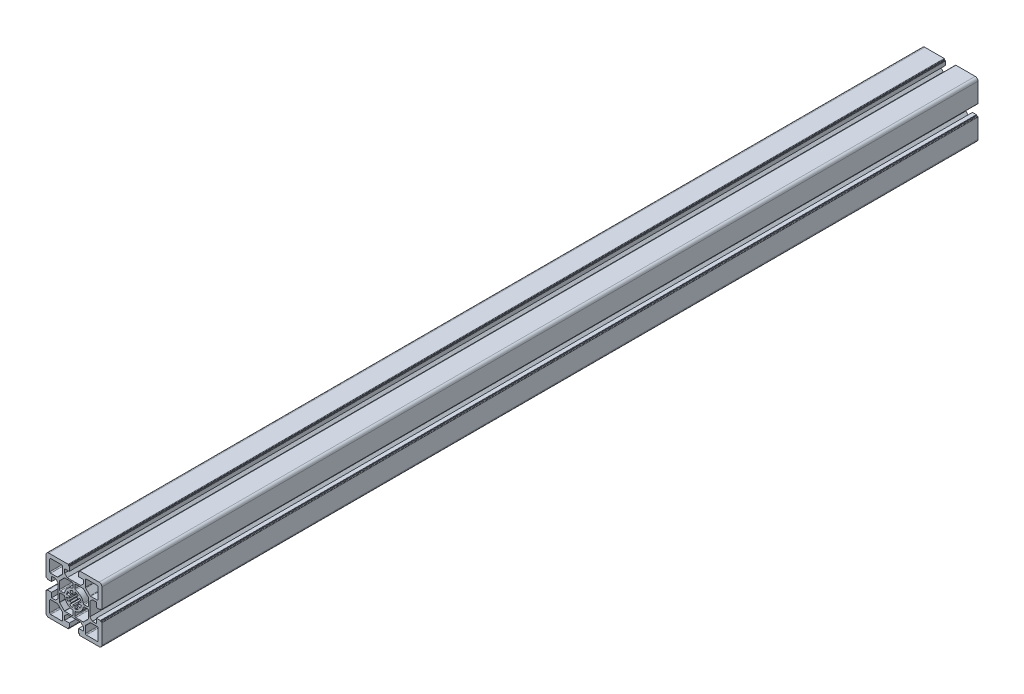
from build123d import *

# Parameters (mm, degrees)
BASE_EXTRUDE_DEPTH = 940
ESCALA1_SCALE      = 0.5


with BuildPart() as part:
    # Sketch1 → Base-Extrude (new body)
    with BuildSketch(Plane.XY):
        with BuildLine():
            Line((7.24997588, 17.000014817), (-2.412e-05, 17.000014817))
            Line((-2.412e-05, 17.000014817), (-7.25002412, 17.000014817))
            Line((-7.25002412, 17.000014817), (-10.05002512, 19.800013819))
            Line((-10.05002512, 19.800013819), (-10.05002512, 24.000014819))
            Line((-10.05002512, 24.000014819), (-5.00002412, 24.000014819))
            Line((-5.00002412, 24.000014819), (-5.00002412, 28.20002069))
            ThreePointArc((-5.00002412, 28.20002069), (-5.08789044, 28.41214864), (-5.300018455, 28.500014819))
            Line((-5.300018455, 28.500014819), (-5.500021455, 28.500014819))
            ThreePointArc((-5.500021455, 28.500014819), (-5.712152769, 28.587882347), (-5.800020455, 28.800013596))
            Line((-5.800020455, 28.800013596), (-5.800020455, 29.500015192))
            ThreePointArc((-5.800020455, 29.500015192), (-5.946466955, 29.853568318), (-6.300020081, 30.000014817))
            Line((-6.300020081, 30.000014817), (-27.000022696, 30.000014817))
            ThreePointArc((-27.000022696, 30.000014817), (-29.121341455, 29.121335817), (-30.000020455, 27.000017059))
            Line((-30.000020455, 27.000017059), (-30.000020455, 6.300013444))
            ThreePointArc((-30.000020455, 6.300013444), (-29.853573955, 5.946460317), (-29.500020828, 5.800013817))
            Line((-29.500020828, 5.800013817), (-28.800019731, 5.800013817))
            ThreePointArc((-28.800019731, 5.800013817), (-28.587888208, 5.712146064), (-28.500020455, 5.500014542))
            Line((-28.500020455, 5.500014542), (-28.500020455, 5.300014093))
            ThreePointArc((-28.500020455, 5.300014093), (-28.412152701, 5.087882571), (-28.200021179, 5.000014817))
            Line((-28.200021179, 5.000014817), (-24.000020455, 5.000014817))
            Line((-24.000020455, 5.000014817), (-24.000020455, 10.050012866))
            Line((-24.000020455, 10.050012866), (-19.800019665, 10.050012866))
            Line((-19.800019665, 10.050012866), (-17.000019665, 7.250013866))
            Line((-17.000019665, 7.250013866), (-17.000019665, 4.3167e-05))
            Line((-17.000019665, 4.3167e-05), (-17.000019665, -7.249956831))
            Line((-17.000019665, -7.249956831), (-19.800019665, -10.049955831))
            Line((-19.800019665, -10.049955831), (-24.000020455, -10.049955831))
            Line((-24.000020455, -10.049955831), (-24.000020455, -4.999957783))
            Line((-24.000020455, -4.999957783), (-28.200021179, -4.999957783))
            ThreePointArc((-28.200021179, -4.999957783), (-28.412152701, -5.087825536), (-28.500020455, -5.299957058))
            Line((-28.500020455, -5.299957058), (-28.500020455, -5.499957507))
            ThreePointArc((-28.500020455, -5.499957507), (-28.587888208, -5.712089029), (-28.800019731, -5.799956783))
            Line((-28.800019731, -5.799956783), (-29.500020828, -5.799956783))
            ThreePointArc((-29.500020828, -5.799956783), (-29.853573955, -5.946403283), (-30.000020455, -6.299956409))
            Line((-30.000020455, -6.299956409), (-30.000020455, -26.999960024))
            ThreePointArc((-30.000020455, -26.999960024), (-29.121341455, -29.121278783), (-27.000022696, -29.999957783))
            Line((-27.000022696, -29.999957783), (-6.300020081, -29.999957783))
            ThreePointArc((-6.300020081, -29.999957783), (-5.946466955, -29.853511283), (-5.800020455, -29.499958157))
            Line((-5.800020455, -29.499958157), (-5.800020455, -28.799956561))
            ThreePointArc((-5.800020455, -28.799956561), (-5.712152769, -28.587825312), (-5.500021455, -28.499957784))
            Line((-5.500021455, -28.499957784), (-5.300018455, -28.499957784))
            ThreePointArc((-5.300018455, -28.499957784), (-5.08789044, -28.412091605), (-5.00002412, -28.199963655))
            Line((-5.00002412, -28.199963655), (-5.00002412, -23.999957784))
            Line((-5.00002412, -23.999957784), (-10.05002512, -23.999957784))
            Line((-10.05002512, -23.999957784), (-10.05002512, -19.799956784))
            Line((-10.05002512, -19.799956784), (-7.25002412, -16.999957783))
            Line((-7.25002412, -16.999957783), (-2.412e-05, -16.999957783))
            Line((-2.412e-05, -16.999957783), (7.24997588, -16.999957783))
            Line((7.24997588, -16.999957783), (10.04997688, -19.799956784))
            Line((10.04997688, -19.799956784), (10.04997688, -23.999957784))
            Line((10.04997688, -23.999957784), (4.99997588, -23.999957784))
            Line((4.99997588, -23.999957784), (4.99997588, -28.199963655))
            ThreePointArc((4.99997588, -28.199963655), (5.0878422, -28.412091605), (5.299970215, -28.499957784))
            Line((5.299970215, -28.499957784), (5.499973215, -28.499957784))
            ThreePointArc((5.499973215, -28.499957784), (5.71210453, -28.587825312), (5.799972216, -28.799956561))
            Line((5.799972216, -28.799956561), (5.799972216, -29.499958157))
            ThreePointArc((5.799972216, -29.499958157), (5.946418716, -29.853511283), (6.299971842, -29.999957783))
            Line((6.299971842, -29.999957783), (26.999974457, -29.999957783))
            ThreePointArc((26.999974457, -29.999957783), (29.121293215, -29.121278783), (29.999972215, -26.999960024))
            Line((29.999972215, -26.999960024), (29.999972215, -6.299956409))
            ThreePointArc((29.999972215, -6.299956409), (29.853525715, -5.946403283), (29.499972589, -5.799956783))
            Line((29.499972589, -5.799956783), (28.799971491, -5.799956783))
            ThreePointArc((28.799971491, -5.799956783), (28.587839969, -5.712089029), (28.499972215, -5.499957507))
            Line((28.499972215, -5.499957507), (28.499972215, -5.299957058))
            ThreePointArc((28.499972215, -5.299957058), (28.412104462, -5.087825536), (28.199972939, -4.999957783))
            Line((28.199972939, -4.999957783), (23.999972215, -4.999957783))
            Line((23.999972215, -4.999957783), (23.999972215, -10.049955831))
            Line((23.999972215, -10.049955831), (19.799971426, -10.049955831))
            Line((19.799971426, -10.049955831), (16.999971426, -7.249956831))
            Line((16.999971426, -7.249956831), (16.999971426, 4.3167e-05))
            Line((16.999971426, 4.3167e-05), (16.999971426, 7.250013866))
            Line((16.999971426, 7.250013866), (19.799971426, 10.050012866))
            Line((19.799971426, 10.050012866), (23.999972215, 10.050012866))
            Line((23.999972215, 10.050012866), (23.999972215, 5.000014817))
            Line((23.999972215, 5.000014817), (28.199972939, 5.000014817))
            ThreePointArc((28.199972939, 5.000014817), (28.412104462, 5.087882571), (28.499972215, 5.300014093))
            Line((28.499972215, 5.300014093), (28.499972215, 5.500014542))
            ThreePointArc((28.499972215, 5.500014542), (28.587839969, 5.712146064), (28.799971491, 5.800013817))
            Line((28.799971491, 5.800013817), (29.499972589, 5.800013817))
            ThreePointArc((29.499972589, 5.800013817), (29.853525715, 5.946460317), (29.999972215, 6.300013444))
            Line((29.999972215, 6.300013444), (29.999972215, 27.000017059))
            ThreePointArc((29.999972215, 27.000017059), (29.121293215, 29.121335817), (26.999974457, 30.000014817))
            Line((26.999974457, 30.000014817), (6.299971842, 30.000014817))
            ThreePointArc((6.299971842, 30.000014817), (5.946418716, 29.853568318), (5.799972216, 29.500015192))
            Line((5.799972216, 29.500015192), (5.799972216, 28.800013596))
            ThreePointArc((5.799972216, 28.800013596), (5.71210453, 28.587882347), (5.499973215, 28.500014819))
            Line((5.499973215, 28.500014819), (5.299970215, 28.500014819))
            ThreePointArc((5.299970215, 28.500014819), (5.0878422, 28.41214864), (4.99997588, 28.20002069))
            Line((4.99997588, 28.20002069), (4.99997588, 24.000014819))
            Line((4.99997588, 24.000014819), (10.04997688, 24.000014819))
            Line((10.04997688, 24.000014819), (10.04997688, 19.800013819))
            Line((10.04997688, 19.800013819), (7.24997588, 17.000014817))
        make_face()
        with BuildLine():
            Line((24.999970687, 12.300015508), (17.964182773, 12.300015508))
            ThreePointArc((17.964182773, 12.300015508), (17.581498992, 12.376136067), (17.257075378, 12.59290907))
            Line((17.257075378, 12.59290907), (12.592863552, 17.257122896))
            ThreePointArc((12.592863552, 17.257122896), (12.376090508, 17.581546796), (12.29996994, 17.964230842))
            Line((12.29996994, 17.964230842), (12.29996994, 25.000017255))
            ThreePointArc((12.29996994, 25.000017255), (12.59286294, 25.707123508), (13.299969193, 26.000016508))
            Line((13.299969193, 26.000016508), (24.999970687, 26.000016508))
            ThreePointArc((24.999970687, 26.000016508), (25.70707694, 25.707123508), (25.99996994, 25.000017255))
            Line((25.99996994, 25.000017255), (25.99996994, 13.300014761))
            ThreePointArc((25.99996994, 13.300014761), (25.70707694, 12.592908508), (24.999970687, 12.300015508))
        make_face(mode=Mode.SUBTRACT)
        with BuildLine():
            Line((-0.868254781, 4.924047323), (-1.389203942, 7.878492919))
            ThreePointArc((-1.389203942, 7.878492919), (-3.061491097, 7.391065963), (-4.588639176, 6.553242527))
            Line((-4.588639176, 6.553242527), (-2.867900032, 4.095774325))
            ThreePointArc((-2.867900032, 4.095774325), (-3.535545186, 3.535556326), (-4.095767305, 2.867914629))
            Line((-4.095767305, 2.867914629), (-6.553231573, 4.588649719))
            ThreePointArc((-6.553231573, 4.588649719), (-7.391053065, 3.061505388), (-7.878479822, 1.389222571))
            Line((-7.878479822, 1.389222571), (-4.924052211, 0.868276934))
            ThreePointArc((-4.924052211, 0.868276934), (-5.000015145, 2.8517e-05), (-4.924052211, -0.8682199))
            Line((-4.924052211, -0.8682199), (-7.878479822, -1.389165536))
            ThreePointArc((-7.878479822, -1.389165536), (-7.391053065, -3.061448353), (-6.553231573, -4.588592684))
            Line((-6.553231573, -4.588592684), (-4.095767305, -2.867857594))
            ThreePointArc((-4.095767305, -2.867857594), (-3.535545186, -3.535499291), (-2.867900032, -4.09571729))
            Line((-2.867900032, -4.09571729), (-4.588639176, -6.553185492))
            ThreePointArc((-4.588639176, -6.553185492), (-3.061491097, -7.391008929), (-1.389203942, -7.878435884))
            Line((-1.389203942, -7.878435884), (-0.868254781, -4.923990288))
            ThreePointArc((-0.868254781, -4.923990288), (-0.435797618, -4.980922606), (-2.412e-05, -4.999947433))
            ThreePointArc((-2.412e-05, -4.999947433), (0.435749379, -4.980922606), (0.868206541, -4.923990288))
            Line((0.868206541, -4.923990288), (1.389155702, -7.878435884))
            ThreePointArc((1.389155702, -7.878435884), (3.061442857, -7.391008929), (4.588590936, -6.553185492))
            Line((4.588590936, -6.553185492), (2.867851793, -4.09571729))
            ThreePointArc((2.867851793, -4.09571729), (3.535496947, -3.535499291), (4.095719065, -2.867857594))
            Line((4.095719065, -2.867857594), (6.553183334, -4.588592684))
            ThreePointArc((6.553183334, -4.588592684), (7.391004826, -3.061448353), (7.878431582, -1.389165536))
            Line((7.878431582, -1.389165536), (4.924003972, -0.8682199))
            ThreePointArc((4.924003972, -0.8682199), (4.999966905, 2.8517e-05), (4.924003972, 0.868276934))
            Line((4.924003972, 0.868276934), (7.878431582, 1.389222571))
            ThreePointArc((7.878431582, 1.389222571), (7.391004826, 3.061505388), (6.553183334, 4.588649719))
            Line((6.553183334, 4.588649719), (4.095719065, 2.867914629))
            ThreePointArc((4.095719065, 2.867914629), (3.535496947, 3.535556326), (2.867851793, 4.095774325))
            Line((2.867851793, 4.095774325), (4.588590936, 6.553242527))
            ThreePointArc((4.588590936, 6.553242527), (3.061442857, 7.391065963), (1.389155702, 7.878492919))
            Line((1.389155702, 7.878492919), (0.868206541, 4.924047323))
            ThreePointArc((0.868206541, 4.924047323), (0.435749379, 4.980979641), (-2.412e-05, 5.000004467))
            ThreePointArc((-2.412e-05, 5.000004467), (-0.435797618, 4.980979641), (-0.868254781, 4.924047323))
        make_face(mode=Mode.SUBTRACT)
        with BuildLine():
            Line((14.499970687, 1.000016508), (10.969128525, 1.000016508))
            ThreePointArc((10.969128525, 1.000016508), (10.328572063, 1.232105996), (9.985348997, 1.820643198))
            ThreePointArc((9.985348997, 1.820643198), (7.177103386, 7.177150109), (1.820595849, 9.985394525))
            ThreePointArc((1.820595849, 9.985394525), (1.232058499, 10.328617545), (0.99996894, 10.969174093))
            Line((0.99996894, 10.969174093), (0.99996894, 14.500017255))
            ThreePointArc((0.99996894, 14.500017255), (1.29286194, 15.207123508), (1.999968193, 15.500016508))
            Line((1.999968193, 15.500016508), (9.900222627, 15.500016508))
            ThreePointArc((9.900222627, 15.500016508), (10.091564812, 15.461956186), (10.253776891, 15.353569557))
            Line((10.253776891, 15.353569557), (15.35352292, 10.253824528))
            ThreePointArc((15.35352292, 10.253824528), (15.461909599, 10.091612425), (15.49996994, 9.900270195))
            Line((15.49996994, 9.900270195), (15.49996994, 2.000015761))
            ThreePointArc((15.49996994, 2.000015761), (15.20707694, 1.292909508), (14.499970687, 1.000016508))
        make_face(mode=Mode.SUBTRACT)
        with BuildLine():
            Line((-25.000018927, -12.299958473), (-17.964231013, -12.299958473))
            ThreePointArc((-17.964231013, -12.299958473), (-17.581547231, -12.376079032), (-17.257123618, -12.592852035))
            Line((-17.257123618, -12.592852035), (-12.592911792, -17.257065861))
            ThreePointArc((-12.592911792, -17.257065861), (-12.376138748, -17.581489761), (-12.30001818, -17.964173807))
            Line((-12.30001818, -17.964173807), (-12.30001818, -24.99996022))
            ThreePointArc((-12.30001818, -24.99996022), (-12.59291118, -25.707066473), (-13.300017432, -25.999959473))
            Line((-13.300017432, -25.999959473), (-25.000018927, -25.999959473))
            ThreePointArc((-25.000018927, -25.999959473), (-25.70712518, -25.707066473), (-26.00001818, -24.99996022))
            Line((-26.00001818, -24.99996022), (-26.00001818, -13.299957726))
            ThreePointArc((-26.00001818, -13.299957726), (-25.70712518, -12.592851473), (-25.000018927, -12.299958473))
        make_face(mode=Mode.SUBTRACT)
        with BuildLine():
            Line((-14.500018927, -0.999959473), (-10.969176764, -0.999959473))
            ThreePointArc((-10.969176764, -0.999959473), (-10.328620302, -1.232048961), (-9.985397236, -1.820586163))
            ThreePointArc((-9.985397236, -1.820586163), (-7.177151626, -7.177093074), (-1.820644088, -9.98533749))
            ThreePointArc((-1.820644088, -9.98533749), (-1.232106738, -10.32856051), (-1.00001718, -10.969117058))
            Line((-1.00001718, -10.969117058), (-1.00001718, -14.49996022))
            ThreePointArc((-1.00001718, -14.49996022), (-1.29291018, -15.207066473), (-2.000016432, -15.499959473))
            Line((-2.000016432, -15.499959473), (-9.900270866, -15.499959473))
            ThreePointArc((-9.900270866, -15.499959473), (-10.091613051, -15.461899151), (-10.25382513, -15.353512523))
            Line((-10.25382513, -15.353512523), (-15.353571159, -10.253767494))
            ThreePointArc((-15.353571159, -10.253767494), (-15.461957839, -10.091555391), (-15.50001818, -9.90021316))
            Line((-15.50001818, -9.90021316), (-15.50001818, -1.999958726))
            ThreePointArc((-15.50001818, -1.999958726), (-15.20712518, -1.292852473), (-14.500018927, -0.999959473))
        make_face(mode=Mode.SUBTRACT)
        with BuildLine():
            Line((0.99996894, -10.969117058), (0.99996894, -14.49996022))
            ThreePointArc((0.99996894, -14.49996022), (1.29286194, -15.207066473), (1.999968193, -15.499959473))
            Line((1.999968193, -15.499959473), (9.900222627, -15.499959473))
            ThreePointArc((9.900222627, -15.499959473), (10.091564812, -15.461899151), (10.253776891, -15.353512523))
            Line((10.253776891, -15.353512523), (15.35352292, -10.253767494))
            ThreePointArc((15.35352292, -10.253767494), (15.461909599, -10.091555391), (15.49996994, -9.90021316))
            Line((15.49996994, -9.90021316), (15.49996994, -1.999958726))
            ThreePointArc((15.49996994, -1.999958726), (15.20707694, -1.292852473), (14.499970687, -0.999959473))
            Line((14.499970687, -0.999959473), (10.969128525, -0.999959473))
            ThreePointArc((10.969128525, -0.999959473), (10.328572063, -1.232048961), (9.985348997, -1.820586163))
            ThreePointArc((9.985348997, -1.820586163), (7.177103386, -7.177093074), (1.820595849, -9.98533749))
            ThreePointArc((1.820595849, -9.98533749), (1.232058499, -10.32856051), (0.99996894, -10.969117058))
        make_face(mode=Mode.SUBTRACT)
        with BuildLine():
            Line((-1.00001718, 10.969174093), (-1.00001718, 14.500017255))
            ThreePointArc((-1.00001718, 14.500017255), (-1.29291018, 15.207123508), (-2.000016432, 15.500016508))
            Line((-2.000016432, 15.500016508), (-9.900270866, 15.500016508))
            ThreePointArc((-9.900270866, 15.500016508), (-10.091613051, 15.461956186), (-10.25382513, 15.353569557))
            Line((-10.25382513, 15.353569557), (-15.353571159, 10.253824528))
            ThreePointArc((-15.353571159, 10.253824528), (-15.461957839, 10.091612425), (-15.50001818, 9.900270195))
            Line((-15.50001818, 9.900270195), (-15.50001818, 2.000015761))
            ThreePointArc((-15.50001818, 2.000015761), (-15.20712518, 1.292909508), (-14.500018927, 1.000016508))
            Line((-14.500018927, 1.000016508), (-10.969176764, 1.000016508))
            ThreePointArc((-10.969176764, 1.000016508), (-10.328620302, 1.232105996), (-9.985397236, 1.820643198))
            ThreePointArc((-9.985397236, 1.820643198), (-7.177151626, 7.177150109), (-1.820644088, 9.985394525))
            ThreePointArc((-1.820644088, 9.985394525), (-1.232106738, 10.328617545), (-1.00001718, 10.969174093))
        make_face(mode=Mode.SUBTRACT)
        with BuildLine():
            Line((-26.00001818, 13.300014761), (-26.00001818, 25.000017255))
            ThreePointArc((-26.00001818, 25.000017255), (-25.70712518, 25.707123508), (-25.000018927, 26.000016508))
            Line((-25.000018927, 26.000016508), (-13.300017432, 26.000016508))
            ThreePointArc((-13.300017432, 26.000016508), (-12.59291118, 25.707123508), (-12.30001818, 25.000017255))
            Line((-12.30001818, 25.000017255), (-12.30001818, 17.964230842))
            ThreePointArc((-12.30001818, 17.964230842), (-12.376138748, 17.581546796), (-12.592911792, 17.257122896))
            Line((-12.592911792, 17.257122896), (-17.257123618, 12.59290907))
            ThreePointArc((-17.257123618, 12.59290907), (-17.581547231, 12.376136067), (-17.964231013, 12.300015508))
            Line((-17.964231013, 12.300015508), (-25.000018927, 12.300015508))
            ThreePointArc((-25.000018927, 12.300015508), (-25.70712518, 12.592908508), (-26.00001818, 13.300014761))
        make_face(mode=Mode.SUBTRACT)
        with BuildLine():
            Line((25.99996994, -13.299957726), (25.99996994, -24.99996022))
            ThreePointArc((25.99996994, -24.99996022), (25.70707694, -25.707066473), (24.999970687, -25.999959473))
            Line((24.999970687, -25.999959473), (13.299969193, -25.999959473))
            ThreePointArc((13.299969193, -25.999959473), (12.59286294, -25.707066473), (12.29996994, -24.99996022))
            Line((12.29996994, -24.99996022), (12.29996994, -17.964173807))
            ThreePointArc((12.29996994, -17.964173807), (12.376090508, -17.581489761), (12.592863552, -17.257065861))
            Line((12.592863552, -17.257065861), (17.257075378, -12.592852035))
            ThreePointArc((17.257075378, -12.592852035), (17.581498992, -12.376079032), (17.964182773, -12.299958473))
            Line((17.964182773, -12.299958473), (24.999970687, -12.299958473))
            ThreePointArc((24.999970687, -12.299958473), (25.70707694, -12.592851473), (25.99996994, -13.299957726))
        make_face(mode=Mode.SUBTRACT)
    extrude(amount=-BASE_EXTRUDE_DEPTH)


with BuildPart() as part_1:
    # Escala1: scaled about (0, 0, 0)
    add(part.part.scale(ESCALA1_SCALE))


solid = part_1.part
